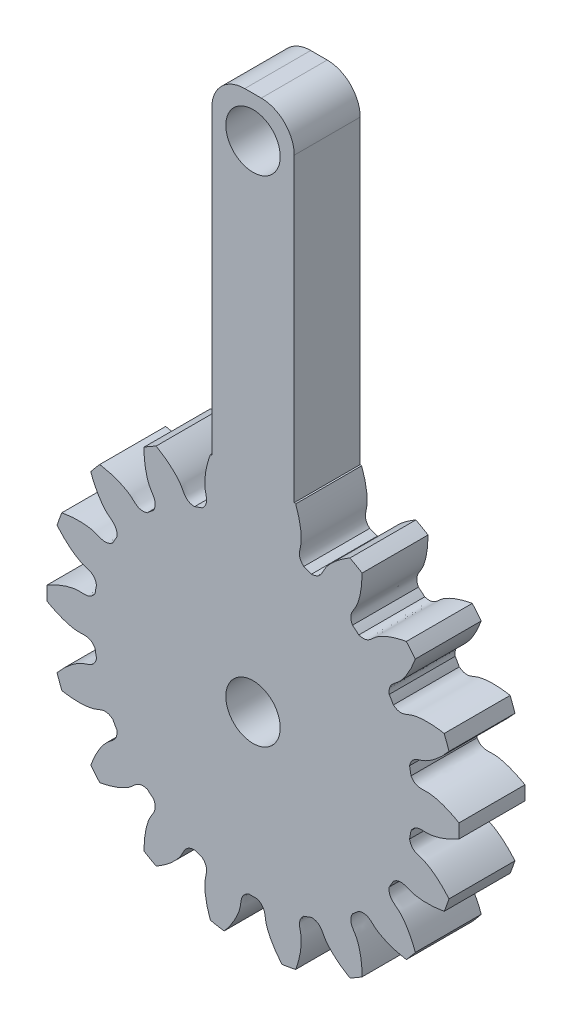
from build123d import *

# Parameters (mm, degrees)
SKETCH_1_R               = 12.5
EXTRUDE_1_DEPTH          = 4
CUT_EXTRUDE_1_DEPTH      = 19.12456896
PATTERN_CIRCULAR_1_COUNT = 18
SKETCH_4_R               = 1.65
CUT_EXTRUDE_2_DEPTH      = 10
SKETCH_5_W               = 5
SKETCH_5_H               = 24.314210766
SKETCH_5_R               = 1.65
EXTRUDE_2_DEPTH          = 4
FILLET_1_R               = 2


with BuildPart() as part:
    # 草图1 → 凸台-拉伸1 (new body)
    with BuildSketch(Plane.XY):
        Circle(SKETCH_1_R)
    extrude(amount=EXTRUDE_1_DEPTH)

    # 草图2 → 切除-拉伸1 (cut, through all)
    with BuildSketch(Plane.XY):
        with BuildLine():
            ThreePointArc((0.249254449, 9.684292874), (0, 9.6875), (-0.249254449, 9.684292874))
            add(Edge.make_bspline(
                [(-0.249254449, 9.684292874), (-0.76888005, 9.898350488), (-0.703486312, 10.298374378), (-0.789791143, 10.678244321), (-0.7984394, 10.713133251), (-0.808884492, 10.751925593), (-0.821280887, 10.794562728), (-0.835787538, 10.84098021), (-0.852559647, 10.891109165), (-0.871751067, 10.944875915), (-0.893513396, 11.002202161), (-0.917996094, 11.063004996), (-0.945346283, 11.127196973), (-0.975708651, 11.194686165), (-1.009225323, 11.265376225), (-1.046035746, 11.339166457), (-1.086276569, 11.41595188), (-1.130081531, 11.495623304), (-1.177581345, 11.578067405), (-1.228903588, 11.663166799), (-1.28417259, 11.750800128), (-1.343509328, 11.84084214), (-1.407031319, 11.933163775), (-1.474852518, 12.027632257), (-1.547083214, 12.124111182), (-1.623829934, 12.222460613), (-1.705195343, 12.32253718), (-1.791278154, 12.424194171), (-1.882173032, 12.527281643), (-1.977970504, 12.631646517), (-2.078756878, 12.737132691), (-2.184614151, 12.843581143), (-2.295619932, 12.950830044), (-2.411847363, 13.05871487), (-2.533365041, 13.167068516), (-2.660236943, 13.275721413), (-2.792522359, 13.384501647), (-2.930275825, 13.493235075), (-3.073547051, 13.601745454), (-3.222380872, 13.709854557), (-3.376817155, 13.817382307), (-3.592594191, 13.961299395), (-3.759444298, 14.065417224), (-3.873201114, 14.133347975)],
                knots=[0, 0, 0, 0, 0.187591972, 0.192996016, 0.1991206, 0.205965723, 0.213531386, 0.221817587, 0.230824328, 0.240551609, 0.250999428, 0.262167787, 0.274056685, 0.286666122, 0.299996099, 0.314046614, 0.32881767, 0.344309264, 0.360521397, 0.37745407, 0.395107283, 0.413481034, 0.432575325, 0.452390155, 0.472925524, 0.494181432, 0.51615788, 0.538854867, 0.562272393, 0.586410459, 0.611269064, 0.636848208, 0.663147891, 0.690168114, 0.717908876, 0.746370177, 0.775552017, 0.805454397, 0.836077316, 0.867420774, 0.899484772, 0.932269309, 1, 1, 1, 1], degree=3))
            ThreePointArc((-3.873201114, 14.133347975), (0, 14.654460476), (3.873201114, 14.133347975))
            add(Edge.make_bspline(
                [(0.249254449, 9.684292874), (0.76888005, 9.898350488), (0.703486312, 10.298374378), (0.789791143, 10.678244321), (0.7984394, 10.713133251), (0.808884492, 10.751925593), (0.821280887, 10.794562728), (0.835787538, 10.84098021), (0.852559647, 10.891109165), (0.871751067, 10.944875915), (0.893513396, 11.002202161), (0.917996094, 11.063004996), (0.945346283, 11.127196973), (0.975708651, 11.194686165), (1.009225323, 11.265376225), (1.046035746, 11.339166457), (1.086276569, 11.41595188), (1.130081531, 11.495623304), (1.177581345, 11.578067405), (1.228903588, 11.663166799), (1.28417259, 11.750800128), (1.343509328, 11.84084214), (1.407031319, 11.933163775), (1.474852518, 12.027632257), (1.547083214, 12.124111182), (1.623829934, 12.222460613), (1.705195343, 12.32253718), (1.791278154, 12.424194171), (1.882173032, 12.527281643), (1.977970504, 12.631646517), (2.078756878, 12.737132691), (2.184614151, 12.843581143), (2.295619932, 12.950830044), (2.411847363, 13.05871487), (2.533365041, 13.167068516), (2.660236943, 13.275721413), (2.792522359, 13.384501647), (2.930275825, 13.493235075), (3.073547051, 13.601745454), (3.222380872, 13.709854557), (3.376817155, 13.817382307), (3.592594191, 13.961299395), (3.759444298, 14.065417224), (3.873201114, 14.133347975)],
                knots=[0, 0, 0, 0, 0.187591972, 0.192996016, 0.1991206, 0.205965723, 0.213531386, 0.221817587, 0.230824328, 0.240551609, 0.250999428, 0.262167787, 0.274056685, 0.286666122, 0.299996099, 0.314046614, 0.32881767, 0.344309264, 0.360521397, 0.37745407, 0.395107283, 0.413481034, 0.432575325, 0.452390155, 0.472925524, 0.494181432, 0.51615788, 0.538854867, 0.562272393, 0.586410459, 0.611269064, 0.636848208, 0.663147891, 0.690168114, 0.717908876, 0.746370177, 0.775552017, 0.805454397, 0.836077316, 0.867420774, 0.899484772, 0.932269309, 1, 1, 1, 1], degree=3))
        make_face()
    cut_extrude_1 = extrude(amount=CUT_EXTRUDE_1_DEPTH, mode=Mode.SUBTRACT)

    # 阵列(圆周)1: 切除-拉伸1 ×18 about axis
    pattern_circular_1_axis = Axis((0, 0, -0.15), (0, 0, 1))
    for i in range(1, PATTERN_CIRCULAR_1_COUNT):
        add(cut_extrude_1.rotate(pattern_circular_1_axis, i * 360 / PATTERN_CIRCULAR_1_COUNT), mode=Mode.SUBTRACT)

    # 草图4 → 切除-拉伸2 (cut)
    with BuildSketch(Plane.XY.offset(4)):
        Circle(SKETCH_4_R)
    extrude(amount=-CUT_EXTRUDE_2_DEPTH, mode=Mode.SUBTRACT)

    # 草图5 → 凸台-拉伸2 (add)
    with BuildSketch(Plane.XY.offset(4)):
        with Locations((0, 20.342894617)):
            Rectangle(SKETCH_5_W, SKETCH_5_H)
        with Locations((0, 30)):
            Circle(SKETCH_5_R, mode=Mode.SUBTRACT)
    extrude(amount=-EXTRUDE_2_DEPTH)

    # 圆角1
    fillet_1_edges = [part.edges().sort_by_distance(p)[0] for p in [
        (2.5, 32.5, 2),
        (-2.5, 32.5, 2),
    ]]
    fillet(fillet_1_edges, radius=FILLET_1_R)


solid = part.part
